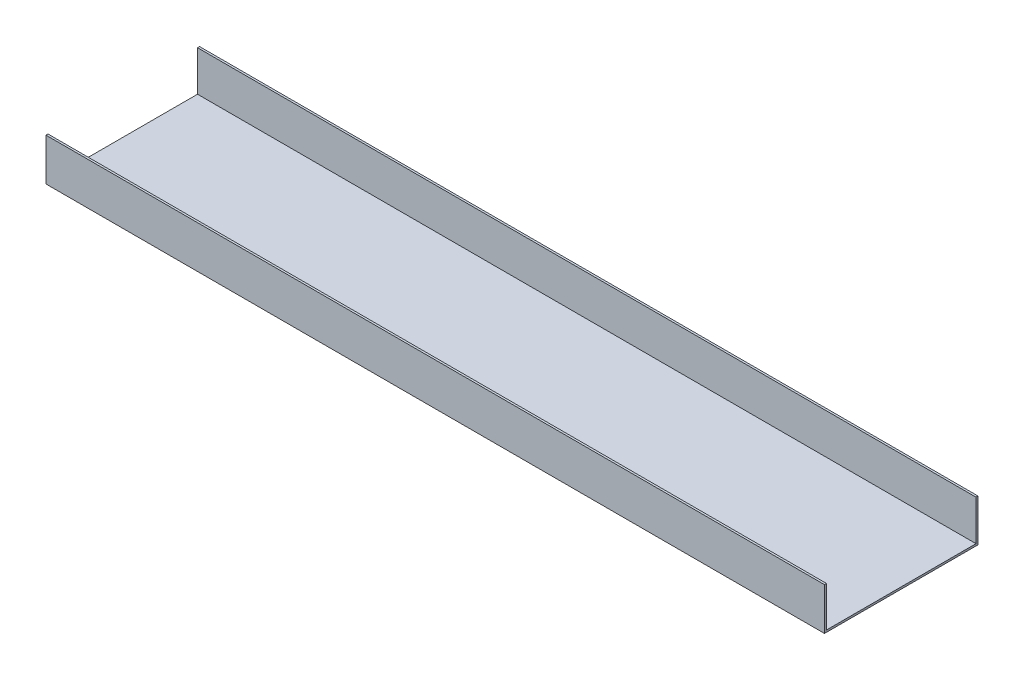
from build123d import *

# Parameters (mm, degrees)
SKETCH1_W           = 386.4
SKETCH1_H           = 76.2
BOSS_EXTRUDE1_DEPTH = 1
SKETCH2_W           = 386.4
SKETCH2_H           = 1
EXTRUDE_THIN1_DEPTH = 20
SKETCH5_W           = 386.4
SKETCH5_H           = 1
EXTRUDE_THIN2_DEPTH = 20


with BuildPart() as part:
    # Sketch1 → Boss-Extrude1 (new body)
    with BuildSketch(Plane(origin=(0, 0, 0), x_dir=(1, 0, 0), z_dir=(0, 1, 0))):
        Rectangle(SKETCH1_W, SKETCH1_H)
    extrude(amount=BOSS_EXTRUDE1_DEPTH)

    # Sketch2 → Extrude-Thin1 (add)
    with BuildSketch(Plane(origin=(0, 1, 0), x_dir=(1, 0, 0), z_dir=(0, 1, 0))):
        with Locations((0, -37.6)):
            Rectangle(SKETCH2_W, SKETCH2_H)
    extrude(amount=EXTRUDE_THIN1_DEPTH)

    # Sketch5 → Extrude-Thin2 (add)
    with BuildSketch(Plane(origin=(0, 1, 0), x_dir=(1, 0, 0), z_dir=(0, 1, 0))):
        with Locations((0, 37.6)):
            Rectangle(SKETCH5_W, SKETCH5_H)
    extrude(amount=EXTRUDE_THIN2_DEPTH)


solid = part.part
